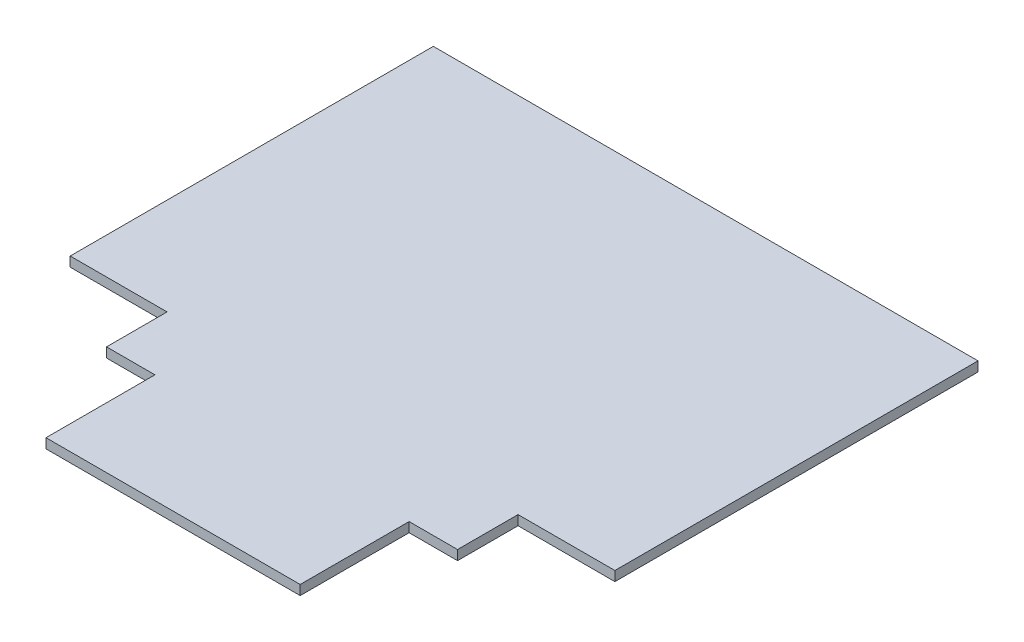
from build123d import *

# Parameters (mm, degrees)
BOSS_EXTRUDE1_DEPTH = 4


with BuildPart() as part:
    # Sketch1 → Boss-Extrude1 (new body)
    with BuildSketch(Plane(origin=(0, 0, 0), x_dir=(1, 0, 0), z_dir=(0, 1, 0))):
        Polygon((0, 220), (0, 70), (40, 70), (40, 45), (60, 45), (60, 25), (60, 0), (165, 0), (165, 25), (165, 45), (185, 45), (185, 70), (225, 70), (225, 220), align=None)
    extrude(amount=BOSS_EXTRUDE1_DEPTH)


solid = part.part
